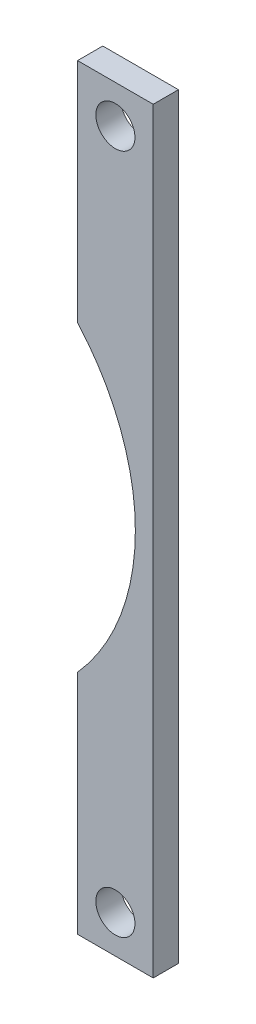
from build123d import *

# Parameters (mm, degrees)
SKETCH_1_W          = 6
SKETCH_1_H          = 60
SKETCH_1_R          = 1.55
EXTRUDE_1_DEPTH     = 2
CUT_EXTRUDE_1_DEPTH = 31.215889859


with BuildPart() as part:
    # ｽｹｯﾁ1 → ﾎﾞｽ - 押し出し1 (new body)
    with BuildSketch(Plane.XY):
        Rectangle(SKETCH_1_W, SKETCH_1_H)
        with Locations((0, 27)):
            Circle(SKETCH_1_R, mode=Mode.SUBTRACT)
        with Locations((0, -27)):
            Circle(SKETCH_1_R, mode=Mode.SUBTRACT)
    extrude(amount=EXTRUDE_1_DEPTH)

    # ｽｹｯﾁ2 → ｶｯﾄ - 押し出し1 (cut, through all)
    with BuildSketch(Plane.XY.offset(2)):
        with BuildLine():
            Line((-3, 12), (-3, -12))
            ThreePointArc((-3, -12), (1.583592135, 0), (-3, 12))
        make_face()
    extrude(amount=-CUT_EXTRUDE_1_DEPTH, mode=Mode.SUBTRACT)


solid = part.part
